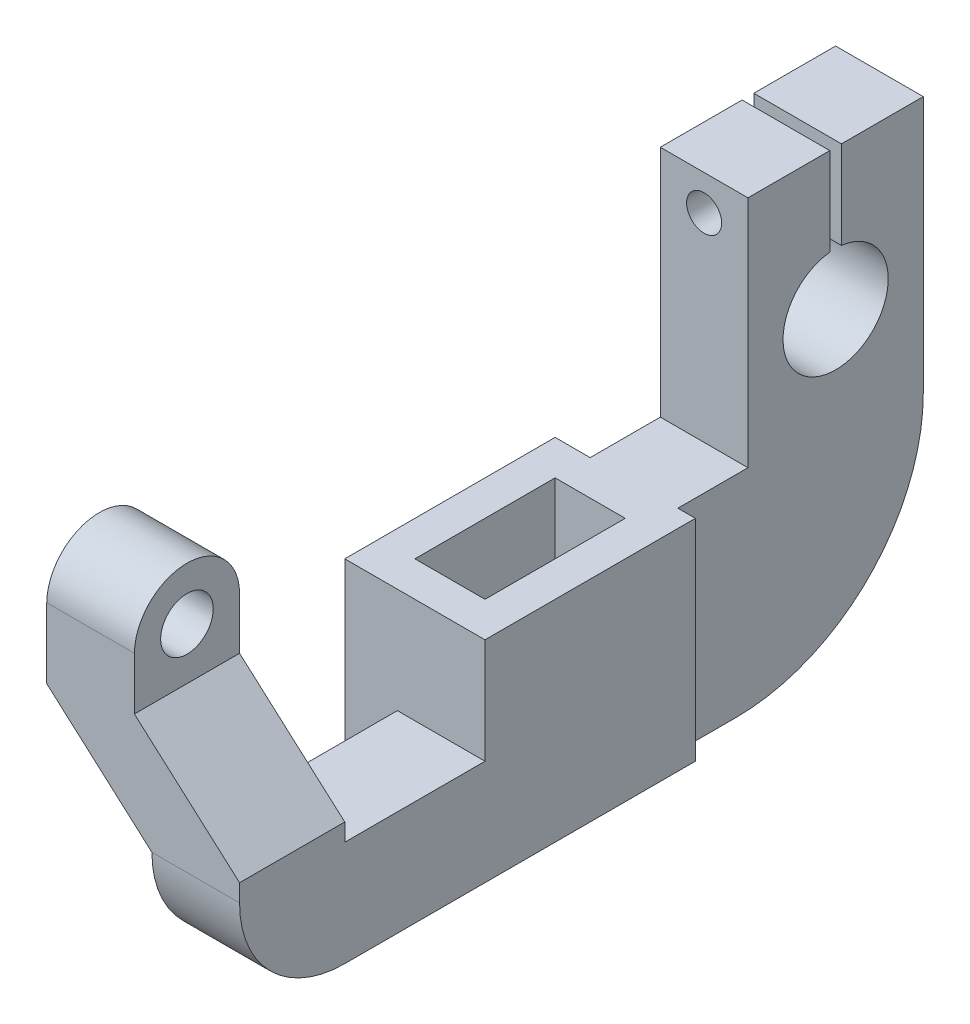
from build123d import *

# Parameters (mm, degrees)
BOSS_EXTRUDE2_DEPTH     = 33
CUT_EXTRUDE1_DEPTH      = 123.331516789
CUT_EXTRUDE1_DEPTH_BACK = 123.331516789
CUT_EXTRUDE2_DEPTH      = 123.331516789
CUT_EXTRUDE2_DEPTH_BACK = 123.331516789
SKETCH1_5_R             = 4.5
CUT_EXTRUDE3_DEPTH      = 123.331516789
CUT_EXTRUDE3_DEPTH_BACK = 123.331516789
SKETCH3_W               = 9
SKETCH3_H               = 48
CUT_EXTRUDE4_DEPTH      = 113.040171367
CUT_EXTRUDE4_DEPTH_BACK = 113.040171367
SKETCH4_W               = 18
SKETCH4_H               = 24
CUT_EXTRUDE5_DEPTH      = 104.870111197
CUT_EXTRUDE5_DEPTH_BACK = 104.870111197
SKETCH5_W               = 9
SKETCH5_H               = 30
CUT_EXTRUDE6_DEPTH      = 104.870111197
CUT_EXTRUDE6_DEPTH_BACK = 104.870111197
SKETCH6_W               = 6
SKETCH6_H               = 42
CUT_EXTRUDE7_DEPTH      = 104.870111197
CUT_EXTRUDE7_DEPTH_BACK = 104.870111197
SKETCH7_W               = 13.713453575
SKETCH7_H               = 47.251215896
CUT_EXTRUDE8_DEPTH      = 104.870111197
CUT_EXTRUDE8_DEPTH_BACK = 104.870111197
SKETCH8_W               = 12
SKETCH8_H               = 24
CUT_EXTRUDE10_REACH     = 124.332
SKETCH9_R               = 3
CUT_EXTRUDE11_DEPTH     = 27
CUT_EXTRUDE12_DEPTH     = 27


with BuildPart() as part:
    # Sketch1 → Boss-Extrude2 (new body)
    with BuildSketch(Plane(origin=(0, 0, 0), x_dir=(0, 0, -1), z_dir=(1, 0, 0))):
        with BuildLine():
            Line((0, 0), (30, 0))
            Line((30, 0), (30, -44))
            ThreePointArc((30, -44), (20.627416998, -66.627416998), (-2, -76))
            Line((-2, -76), (-12, -76))
            Line((-12, -76), (-48, -76))
            Line((-48, -76), (-72, -76))
            ThreePointArc((-72, -76), (-84.727922061, -70.727922061), (-90, -58))
            Line((-90, -58), (-90, -30))
            ThreePointArc((-90, -30), (-81, -21.137772707), (-72, -30))
            Line((-72, -30), (-72, -58))
            Line((-72, -58), (-48, -58))
            Line((-48, -58), (-48, -40))
            Line((-48, -40), (0, -40))
            Line((0, -40), (0, 0))
        make_face()
    extrude(amount=-BOSS_EXTRUDE2_DEPTH)

    # Sketch1<4> → Cut-Extrude1 (cut, two sides: drawn at the far end of the back side and taken through both)
    with BuildSketch(Plane(origin=(0, 0, 0), x_dir=(0, 0, -1), z_dir=(1, 0, 0)).offset(-CUT_EXTRUDE1_DEPTH_BACK)):
        with BuildLine():
            Line((16, 0), (14, 0))
            Line((14, 0), (14, -15.05572809))
            ThreePointArc((14, -15.05572809), (15, -33), (16, -15.05572809))
            Line((16, -15.05572809), (16, 0))
        make_face()
    extrude(amount=CUT_EXTRUDE1_DEPTH + CUT_EXTRUDE1_DEPTH_BACK, mode=Mode.SUBTRACT)

    # Sketch1<5> → Cut-Extrude2 (cut, two sides: drawn at the far end of the back side and taken through both)
    with BuildSketch(Plane(origin=(0, 0, 0), x_dir=(0, 0, -1), z_dir=(1, 0, 0)).offset(-CUT_EXTRUDE2_DEPTH_BACK)):
        with Locations((-81, -30.138843618)):
            Circle(SKETCH1_5_R)
    extrude(amount=CUT_EXTRUDE2_DEPTH + CUT_EXTRUDE2_DEPTH_BACK, mode=Mode.SUBTRACT)

    # Sketch3 → Cut-Extrude3 (cut, two sides: drawn at the far end of the back side and taken through both)
    with BuildSketch(Plane(origin=(0, 0, 0), x_dir=(1, 0, 0), z_dir=(0, 1, 0)).offset(-CUT_EXTRUDE3_DEPTH_BACK)):
        with Locations((-28.5, -24)):
            Rectangle(SKETCH3_W, SKETCH3_H)
    extrude(amount=CUT_EXTRUDE3_DEPTH + CUT_EXTRUDE3_DEPTH_BACK, mode=Mode.SUBTRACT)

    # Sketch4 → Cut-Extrude4 (cut, two sides: drawn at the far end of the back side and taken through both)
    with BuildSketch(Plane(origin=(0, -58, 0), x_dir=(1, 0, 0), z_dir=(0, 1, 0)).offset(-CUT_EXTRUDE4_DEPTH_BACK)):
        with Locations((-24, -60)):
            Rectangle(SKETCH4_W, SKETCH4_H)
    extrude(amount=CUT_EXTRUDE4_DEPTH + CUT_EXTRUDE4_DEPTH_BACK, mode=Mode.SUBTRACT)

    # Sketch5 → Cut-Extrude5 (cut, two sides: drawn at the far end of the back side and taken through both)
    with BuildSketch(Plane(origin=(0, -40, 0), x_dir=(1, 0, 0), z_dir=(0, 1, 0)).offset(-CUT_EXTRUDE5_DEPTH_BACK)):
        with Locations((-28.5, 15)):
            Rectangle(SKETCH5_W, SKETCH5_H)
    extrude(amount=CUT_EXTRUDE5_DEPTH + CUT_EXTRUDE5_DEPTH_BACK, mode=Mode.SUBTRACT)

    # Sketch6 → Cut-Extrude6 (cut, two sides: drawn at the far end of the back side and taken through both)
    with BuildSketch(Plane(origin=(0, -40, 0), x_dir=(1, 0, 0), z_dir=(0, 1, 0)).offset(-CUT_EXTRUDE6_DEPTH_BACK)):
        with Locations((-21, 9)):
            Rectangle(SKETCH6_W, SKETCH6_H)
    extrude(amount=CUT_EXTRUDE6_DEPTH + CUT_EXTRUDE6_DEPTH_BACK, mode=Mode.SUBTRACT)

    # Sketch7 → Cut-Extrude7 (cut, two sides: drawn at the far end of the back side and taken through both)
    with BuildSketch(Plane(origin=(0, -40, 0), x_dir=(1, 0, 0), z_dir=(0, 1, 0)).offset(-CUT_EXTRUDE7_DEPTH_BACK)):
        with Locations((3.856726788, 11.625607948)):
            Rectangle(SKETCH7_W, SKETCH7_H)
    extrude(amount=CUT_EXTRUDE7_DEPTH + CUT_EXTRUDE7_DEPTH_BACK, mode=Mode.SUBTRACT)

    # Sketch8 → Cut-Extrude8 (cut, two sides: drawn at the far end of the back side and taken through both)
    with BuildSketch(Plane(origin=(0, -40, 0), x_dir=(1, 0, 0), z_dir=(0, 1, 0)).offset(-CUT_EXTRUDE8_DEPTH_BACK)):
        with Locations((-12, -30)):
            Rectangle(SKETCH8_W, SKETCH8_H)
    extrude(amount=CUT_EXTRUDE8_DEPTH + CUT_EXTRUDE8_DEPTH_BACK, mode=Mode.SUBTRACT)

    # Sketch9 → Cut-Extrude10 (cut, up to next)
    with BuildSketch(Plane.XY, mode=Mode.PRIVATE) as cut_extrude10_sk1:
        with Locations((-10.5, -6)):
            Circle(SKETCH9_R)
    cut_extrude10_tool1 = extrude(cut_extrude10_sk1.sketch, amount=-CUT_EXTRUDE10_REACH, mode=Mode.PRIVATE) & part.part
    add(cut_extrude10_tool1.solids().sort_by_distance((-10.5, -6, 0))[0], mode=Mode.SUBTRACT)

    # Sketch10 → Cut-Extrude11 (cut)
    with BuildSketch(Plane.XY.offset(90)):
        Polygon((-15, -58), (-33, -42), (-33, -76), (-15, -76), align=None)
    extrude(amount=-CUT_EXTRUDE11_DEPTH, mode=Mode.SUBTRACT)

    # Sketch11 → Cut-Extrude12 (cut)
    with BuildSketch(Plane.XY.offset(90)):
        Polygon((0, -55), (0, -21.137772707), (-18, -21.137772707), (-18, -39), align=None)
    extrude(amount=-CUT_EXTRUDE12_DEPTH, mode=Mode.SUBTRACT)


solid = part.part
